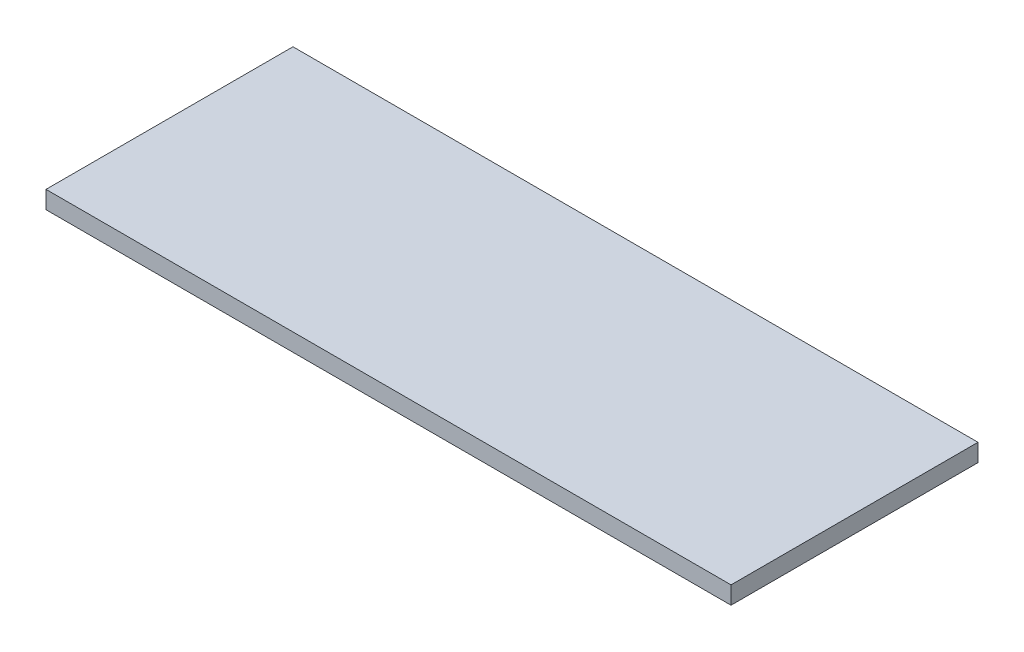
from build123d import *

# Parameters (mm, degrees)
SKETCH1_W           = 116.5
SKETCH1_H           = 42
BOSS_EXTRUDE1_DEPTH = 3


with BuildPart() as part:
    # Sketch1 → Boss-Extrude1 (new body)
    with BuildSketch(Plane(origin=(0, 0, 0), x_dir=(1, 0, 0), z_dir=(0, 1, 0))):
        Rectangle(SKETCH1_W, SKETCH1_H)
    extrude(amount=BOSS_EXTRUDE1_DEPTH)


solid = part.part
